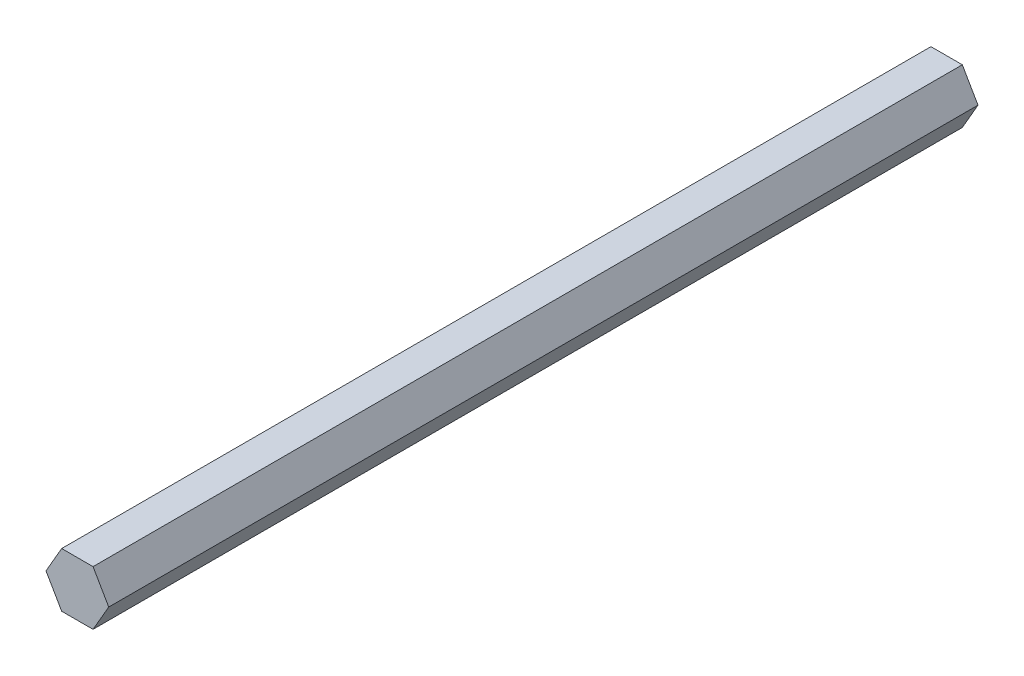
from build123d import *

# Parameters (mm, degrees)
BOSS_EXTRUDE1_DEPTH = 203.2


with BuildPart() as part:
    # Sketch2 → Boss-Extrude1 (new body)
    with BuildSketch(Plane.XY):
        Polygon((7.332348419, 0), (3.666174209, 6.35), (-3.666174209, 6.35), (-7.332348419, 0), (-3.666174209, -6.35), (3.666174209, -6.35), align=None)
    extrude(amount=BOSS_EXTRUDE1_DEPTH)


solid = part.part
